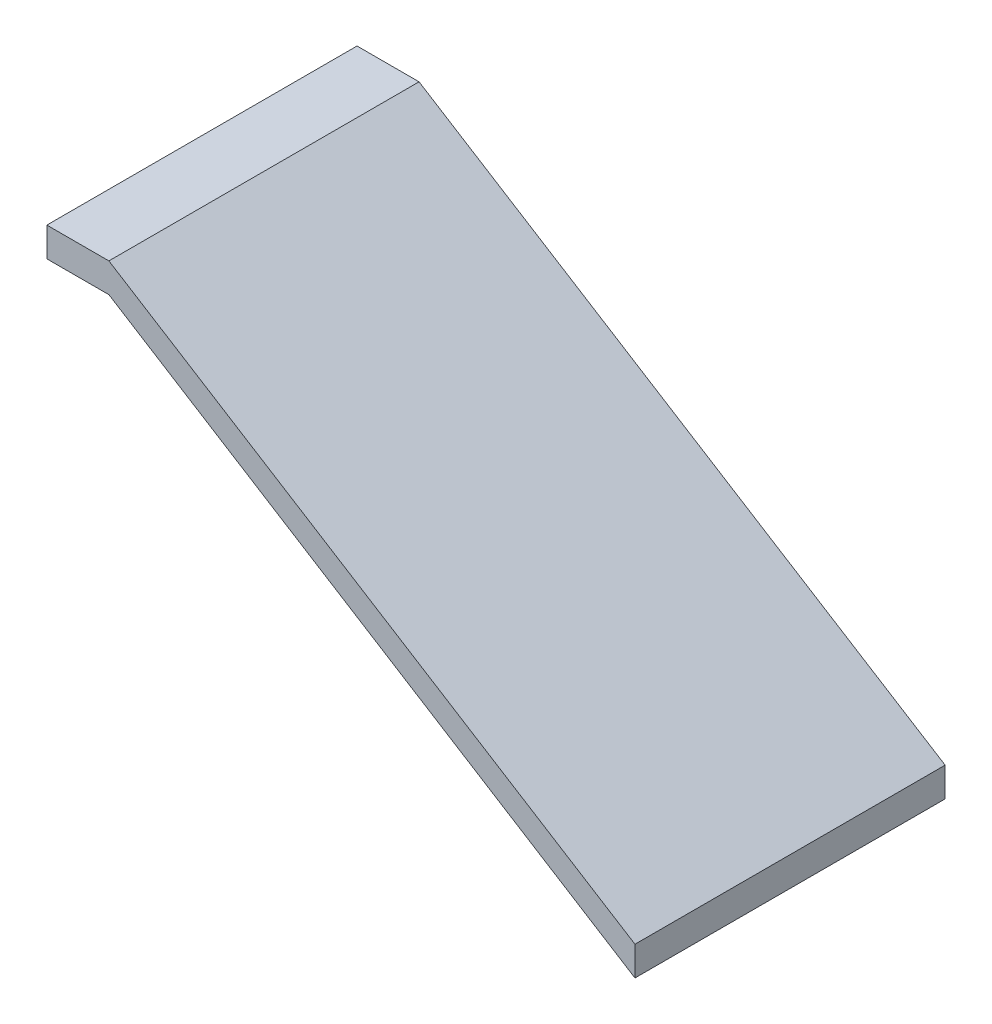
from build123d import *

# Parameters (mm, degrees)
COMPACTED_LOW_PERMEABILITY_BED_NORMAL_40_DEPTH = 500


with BuildPart() as part:
    # 草图1 → Compacted_low_permeability_bed_normal_40 (new body)
    with BuildSketch(Plane.XY):
        Polygon((50, 562.752128099), (150, 562.752128099), (998.048096156, 32.832863866), (998.048096156, 80), (150, 609.919264233), (50, 609.919264233), align=None)
    extrude(amount=COMPACTED_LOW_PERMEABILITY_BED_NORMAL_40_DEPTH)


solid = part.part
